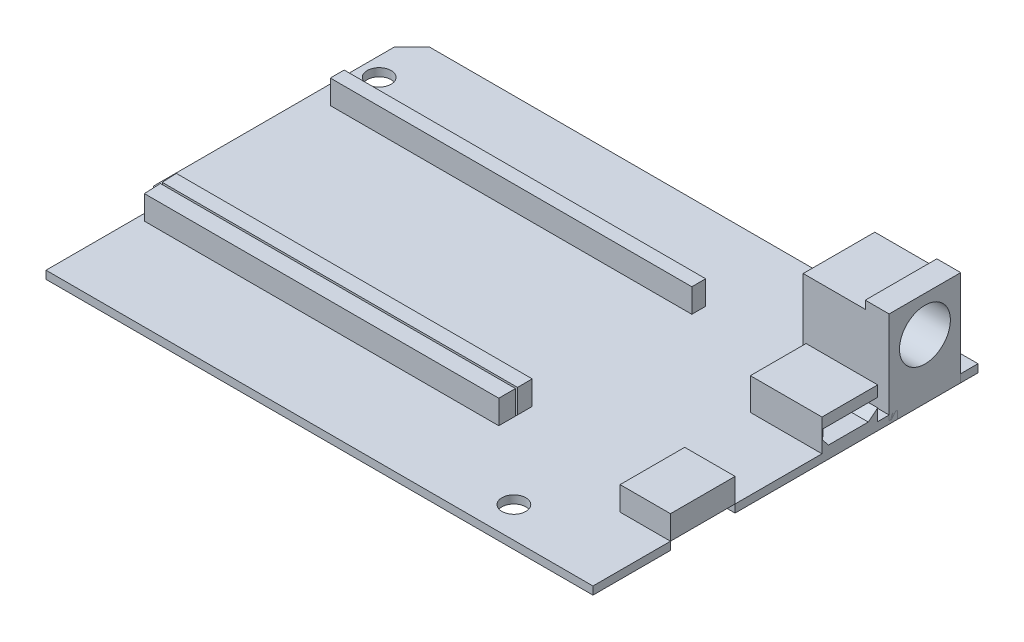
from build123d import *

# Parameters (mm, degrees)
CROQUIS2_R                   = 1.5
CROQUIS2_W                   = 45.430226109
CROQUIS2_H                   = 1.74059968
SALIENTE_EXTRUIR2_DEPTH      = 1
SALIENTE_EXTRUIR5_DEPTH      = 11
SALIENTE_EXTRUIR5_DEPTH_BACK = 1
CROQUIS3_W                   = 10.8
CROQUIS3_H                   = 9
CROQUIS4_R                   = 3.2
CORTAR_EXTRUIR1_DEPTH        = 5
CROQUIS5_W                   = 7.8
CROQUIS5_H                   = 9
CORTAR_EXTRUIR2_DEPTH        = 1
SALIENTE_EXTRUIR6_DEPTH      = 4
SALIENTE_EXTRUIR6_DEPTH_BACK = 1
CROQUIS6_W                   = 9
CROQUIS6_H                   = 7
CORTAR_EXTRUIR3_DEPTH        = 4
CROQUIS8_W                   = 6.329954447
CROQUIS8_H                   = 8.118219625
SALIENTE_EXTRUIR7_DEPTH      = 3
SALIENTE_EXTRUIR8_DEPTH      = 3
SALIENTE_EXTRUIR8_DEPTH_BACK = 1
CROQUIS9_W                   = 45.430226109
CROQUIS9_H                   = 1.74059968


with BuildPart() as part:
    # Croquis2 → Saliente-Extruir2 (new body)
    with BuildSketch(Plane(origin=(0, 0, 0), x_dir=(1, 0, 0), z_dir=(0, 1, 0))):
        Polygon((-114.205989543, 45.350793669), (-183.177349022, 45.350793669), (-185.346387965, 43.181754726), (-185.346387965, 12.898278129), (-182.944348972, 10.496239137), (-182.944348972, 8.483369714), (-182.944348972, -3.035939151), (-114.205989543, -3.035939151), (-114.205989543, 6.703917116), (-120.53594399, 6.703917116), (-120.53594399, 14.822136741), (-114.205989543, 14.822136741), (-114.205989543, 25.822407586), (-118.635147944, 25.822407586), (-118.635147944, 32.742977756), (-114.205989543, 32.742977756), (-114.205989543, 35.225683913), (-125.100189967, 35.225683913), (-125.100189967, 43.181754726), (-114.205989543, 43.181754726), align=None)
        with Locations(Location((-183.186680014, 14.169663208, 0), (0, 0, 270))):
            Circle(CROQUIS2_R, mode=Mode.SUBTRACT)
        Polygon((-182.192965891, 10.586368559), (-182.289134654, 12.689367405), (-137.563892409, 12.689367405), (-137.563892409, 10.586368559), (-137.563892409, 8.483369714), (-182.096797127, 8.483369714), align=None, mode=Mode.SUBTRACT)
        with Locations(Location((-128.03733826, 0.855831955, 0), (0, 0, 270))):
            Circle(CROQUIS2_R, mode=Mode.SUBTRACT)
        with Locations(Location((-182.994118518, 38.885795922, 0), (0, 0, 270))):
            Circle(CROQUIS2_R, mode=Mode.SUBTRACT)
        with Locations((-160.279005464, 33.613277596)):
            Rectangle(CROQUIS2_W, CROQUIS2_H, mode=Mode.SUBTRACT)
        with Locations(Location((-127.070714237, 43.683877878, 0), (0, 0, 270))):
            Circle(CROQUIS2_R, mode=Mode.SUBTRACT)
    extrude(amount=SALIENTE_EXTRUIR2_DEPTH)

    # Croquis6 → Saliente-Extruir6 (add, two sides: drawn at the far end of the back side and taken through both)
    with BuildSketch(Plane(origin=(0, 1, 0), x_dir=(1, 0, 0), z_dir=(0, 1, 0)).offset(-SALIENTE_EXTRUIR6_DEPTH_BACK)):
        with Locations((-118.705989543, 29.242977756)):
            Rectangle(CROQUIS6_W, CROQUIS6_H)
    extrude(amount=SALIENTE_EXTRUIR6_DEPTH + SALIENTE_EXTRUIR6_DEPTH_BACK)

    # Croquis7 → Cortar-Extruir3 (cut)
    with BuildSketch(Plane(origin=(-114.205989543, 0, 0), x_dir=(0, 0, -1), z_dir=(1, 0, 0))):
        Polygon((25.866485873, 3.643487769), (32.752542358, 3.643487769), (32.752542358, 2.505548171), (31.561801116, 1.543487769), (26.561801116, 1.543487769), (25.830702469, 2.448367867), align=None)
    extrude(amount=-CORTAR_EXTRUIR3_DEPTH, mode=Mode.SUBTRACT)

    # Croquis9 → Saliente-Extruir8 (add, two sides: drawn at the far end of the back side and taken through both)
    with BuildSketch(Plane(origin=(0, 1, 0), x_dir=(1, 0, 0), z_dir=(0, 1, 0)).offset(-SALIENTE_EXTRUIR8_DEPTH_BACK)):
        Polygon((-137.563892409, 10.833630724), (-137.563892409, 12.689367405), (-182.289134654, 12.689367405), (-182.204273028, 10.833630724), align=None)
        Polygon((-137.563892409, 8.483369714), (-137.563892409, 10.586368559), (-182.192965891, 10.586368559), (-182.096797127, 8.483369714), align=None)
        with Locations((-160.279005464, 33.613277596)):
            Rectangle(CROQUIS9_W, CROQUIS9_H)
    extrude(amount=SALIENTE_EXTRUIR8_DEPTH + SALIENTE_EXTRUIR8_DEPTH_BACK)


with BuildPart() as body_2:
    # Croquis3 → Saliente-Extruir5 (new, two sides: drawn at the far end of the back side and taken through both)
    with BuildSketch(Plane(origin=(0, 1, 0), x_dir=(1, 0, 0), z_dir=(0, 1, 0)).offset(-SALIENTE_EXTRUIR5_DEPTH_BACK)):
        with Locations((-119.605989543, 38.681754726)):
            Rectangle(CROQUIS3_W, CROQUIS3_H)
    extrude(amount=SALIENTE_EXTRUIR5_DEPTH + SALIENTE_EXTRUIR5_DEPTH_BACK)

    # Croquis4 → Cortar-Extruir1 (cut)
    with BuildSketch(Plane(origin=(-114.205989543, 0, 0), x_dir=(0, 0, -1), z_dir=(1, 0, 0))):
        with Locations((38.681754726, 7.5)):
            Circle(CROQUIS4_R)
    extrude(amount=-CORTAR_EXTRUIR1_DEPTH, mode=Mode.SUBTRACT)

    # Croquis5 → Cortar-Extruir2 (cut)
    with BuildSketch(Plane(origin=(0, 12, 0), x_dir=(1, 0, 0), z_dir=(0, 1, 0))):
        with Locations((-121.105989543, 38.681754726)):
            Rectangle(CROQUIS5_W, CROQUIS5_H)
    extrude(amount=-CORTAR_EXTRUIR2_DEPTH, mode=Mode.SUBTRACT)


with BuildPart() as body_3:
    # Croquis8 → Saliente-Extruir7 (new body)
    with BuildSketch(Plane(origin=(0, 1, 0), x_dir=(1, 0, 0), z_dir=(0, 1, 0))):
        with Locations((-117.370966767, 10.763026929)):
            Rectangle(CROQUIS8_W, CROQUIS8_H)
    extrude(amount=SALIENTE_EXTRUIR7_DEPTH)


solid = Compound([part.part, body_2.part, body_3.part])
